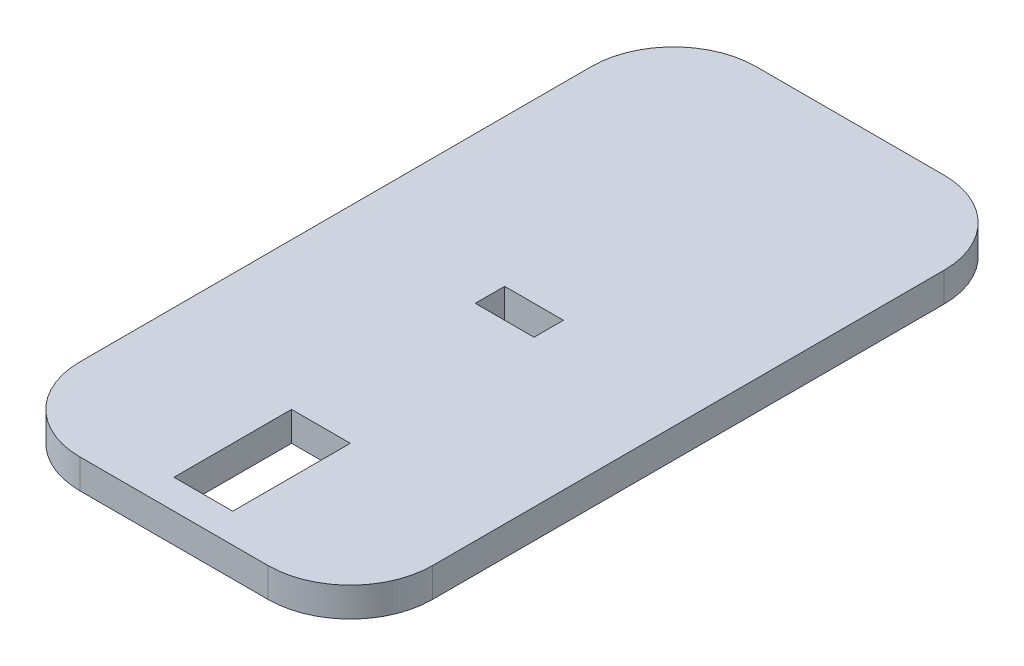
from build123d import *

# Parameters (mm, degrees)
SKETCH1_W           = 12.7
SKETCH1_H           = 6.35
SKETCH1_H_2         = 25.4
BOSS_EXTRUDE1_DEPTH = 6.35


with BuildPart() as part:
    # Sketch1 → Boss-Extrude1 (new body)
    with BuildSketch(Plane(origin=(0, 0, 0), x_dir=(1, 0, 0), z_dir=(0, 1, 0))):
        with BuildLine():
            Line((0, 24.13), (0, 134.62))
            ThreePointArc((0, 134.62), (5.207641431, 147.192358569), (17.78, 152.4))
            Line((17.78, 152.4), (58.42, 152.4))
            ThreePointArc((58.42, 152.4), (70.992358569, 147.192358569), (76.2, 134.62))
            Line((76.2, 134.62), (76.2, 24.13))
            ThreePointArc((76.2, 24.13), (70.992358569, 11.557641431), (58.42, 6.35))
            Line((58.42, 6.35), (17.78, 6.35))
            ThreePointArc((17.78, 6.35), (5.207641431, 11.557641431), (0, 24.13))
        make_face()
        with Locations((38.1, 80.9625)):
            Rectangle(SKETCH1_W, SKETCH1_H, mode=Mode.SUBTRACT)
        with Locations((38.1, 25.4)):
            Rectangle(SKETCH1_W, SKETCH1_H_2, mode=Mode.SUBTRACT)
    extrude(amount=BOSS_EXTRUDE1_DEPTH)


solid = part.part
